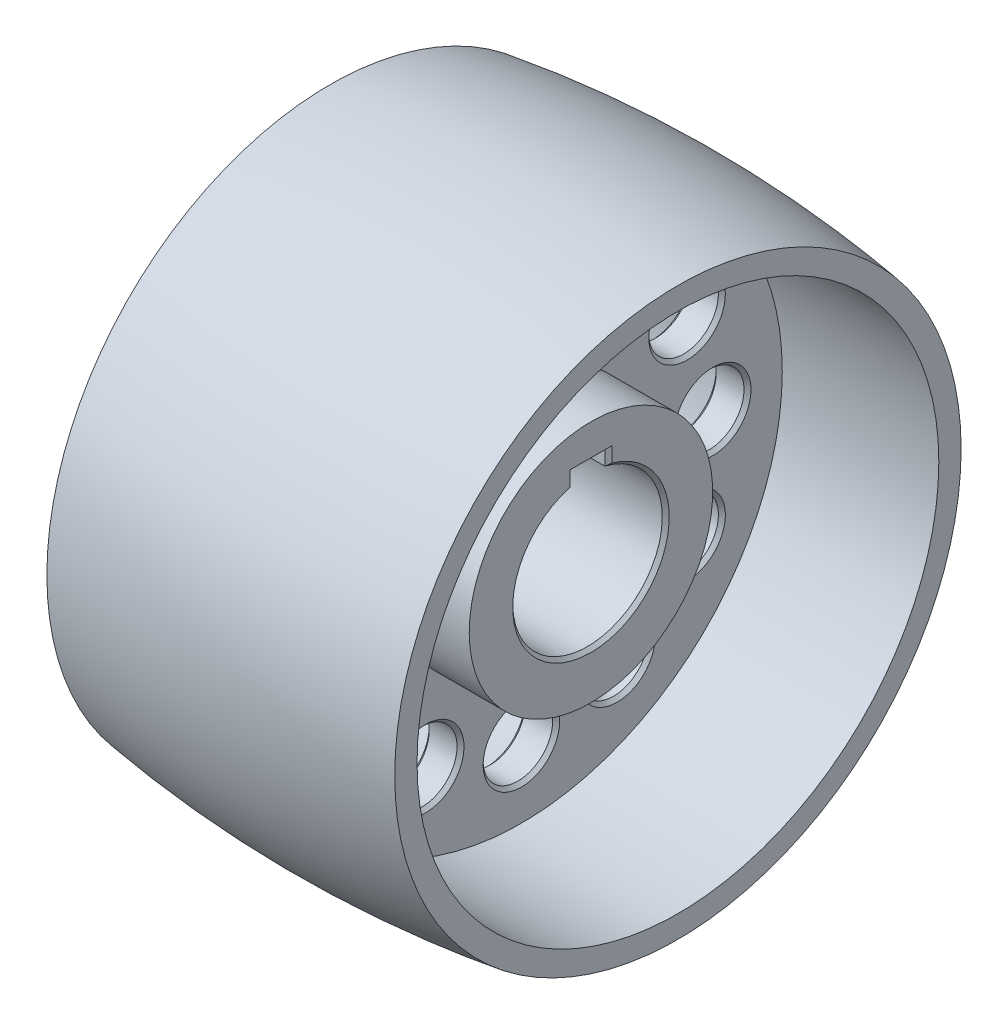
from build123d import *

# Parameters (mm, degrees)
WYTNIJ_WYCI_GNI_CIE1_REACH       = 285.373
SFAZOWANIE1_SIZE                 = 2
WYTNIJ_WYCI_GNI_CIE2_REACH       = 266.386
SZKIC3_R                         = 20
SFAZOWANIE2_SIZE                 = 2
SZYK_KO_OWY1_COUNT               = 12
SFAZOWANIE2_OF_SZYK_KO_OWY1_SIZE = 2


with BuildPart() as part:
    # Szkic1 → Obrót1 (revolve)
    with BuildSketch(Plane.XY, mode=Mode.PRIVATE) as obr_t1_sk:
        with BuildLine():
            Line((-10, 70), (-10, 150))
            Line((-10, 150), (-100, 150))
            Line((-100, 150), (-100, 162.820323028))
            ThreePointArc((-100, 162.820323028), (0, 170), (100, 162.820323028))
            Line((100, 162.820323028), (100, 150))
            Line((100, 150), (10, 150))
            Line((10, 150), (10, 70))
            Line((10, 70), (50, 70))
            Line((50, 70), (50, 0))
            Line((50, 0), (-50, 0))
            Line((-50, 0), (-50, 70))
            Line((-50, 70), (-10, 70))
        make_face()
    revolve(obr_t1_sk.sketch.rotate(Axis((-50, 0, 0), (1, 0, 0)), 90), axis=Axis((-50, 0, 0), (1, 0, 0)))

    # Szkic2 → Wytnij-wyciągnięcie1 (cut, up to next)
    with BuildSketch(Plane.ZY.offset(50), mode=Mode.PRIVATE) as wytnij_wyci_gni_cie1_sk1:
        with BuildLine():
            Line((-10, 50), (-10, 41.821047333))
            ThreePointArc((-10, 41.821047333), (0, -43), (10, 41.821047333))
            Line((10, 41.821047333), (10, 50))
            Line((10, 50), (-10, 50))
        make_face()
    wytnij_wyci_gni_cie1_tool1 = extrude(wytnij_wyci_gni_cie1_sk1.sketch, amount=-WYTNIJ_WYCI_GNI_CIE1_REACH, mode=Mode.PRIVATE) & part.part
    add(wytnij_wyci_gni_cie1_tool1.solids().sort_by_distance((-50, 1.148862, 0))[0], mode=Mode.SUBTRACT)

    # Sfazowanie1
    sfazowanie1_edges = [part.edges().sort_by_distance(p)[0] for p in [
        (50, 50, 0),
        (-50, 50, 0),
        (50, 45.910523666, 10),
        (-50, 45.910523666, 10),
        (-50, 45.910523666, -10),
        (-50, -43, 0),
        (50, -43, 0),
        (50, 45.910523666, -10),
    ]]
    chamfer(sfazowanie1_edges, length=SFAZOWANIE1_SIZE)

    # Szkic3 → Wytnij-wyciągnięcie2 (cut, up to next)
    with BuildSketch(Plane.ZY.offset(10), mode=Mode.PRIVATE) as wytnij_wyci_gni_cie2_sk1:
        with Locations((0, 110)):
            Circle(SZKIC3_R)
    wytnij_wyci_gni_cie2_tool1 = extrude(wytnij_wyci_gni_cie2_sk1.sketch, amount=-WYTNIJ_WYCI_GNI_CIE2_REACH, mode=Mode.PRIVATE) & part.part
    wytnij_wyci_gni_cie2 = wytnij_wyci_gni_cie2_tool1.solids().sort_by_distance((-10, 110, 0))[0]
    add(wytnij_wyci_gni_cie2, mode=Mode.SUBTRACT)

    # Sfazowanie2
    sfazowanie2_edges = [part.edges().sort_by_distance(p)[0] for p in [
        (-10, 110, -20),
        (10, 110, -20),
    ]]
    chamfer(sfazowanie2_edges, length=SFAZOWANIE2_SIZE)

    # Szyk kołowy1: Wytnij-wyciągnięcie2 ×12 about axis
    szyk_ko_owy1_axis = Axis((0, 0, 0), (1, 0, 0))
    for i in range(1, SZYK_KO_OWY1_COUNT):
        add(wytnij_wyci_gni_cie2.rotate(szyk_ko_owy1_axis, i * 360 / SZYK_KO_OWY1_COUNT), mode=Mode.SUBTRACT)

    # Sfazowanie2 of Szyk kołowy1
    sfazowanie2_of_szyk_ko_owy1_edges = [part.edges().sort_by_distance(p)[0] for p in [
        (-10, 105.262794416, 37.679491924),
        (10, 105.262794416, 37.679491924),
        (-10, 72.320508076, 85.262794416),
        (10, 72.320508076, 85.262794416),
        (-10, 20, 110),
        (10, 20, 110),
        (-10, -37.679491924, 105.262794416),
        (10, -37.679491924, 105.262794416),
        (-10, -85.262794416, 72.320508076),
        (10, -85.262794416, 72.320508076),
        (-10, -110, 20),
        (10, -110, 20),
        (-10, -105.262794416, -37.679491924),
        (10, -105.262794416, -37.679491924),
        (-10, -72.320508076, -85.262794416),
        (10, -72.320508076, -85.262794416),
        (-10, -20, -110),
        (10, -20, -110),
        (-10, 37.679491924, -105.262794416),
        (10, 37.679491924, -105.262794416),
        (-10, 85.262794416, -72.320508076),
        (10, 85.262794416, -72.320508076),
    ]]
    chamfer(sfazowanie2_of_szyk_ko_owy1_edges, length=SFAZOWANIE2_OF_SZYK_KO_OWY1_SIZE)


solid = part.part
